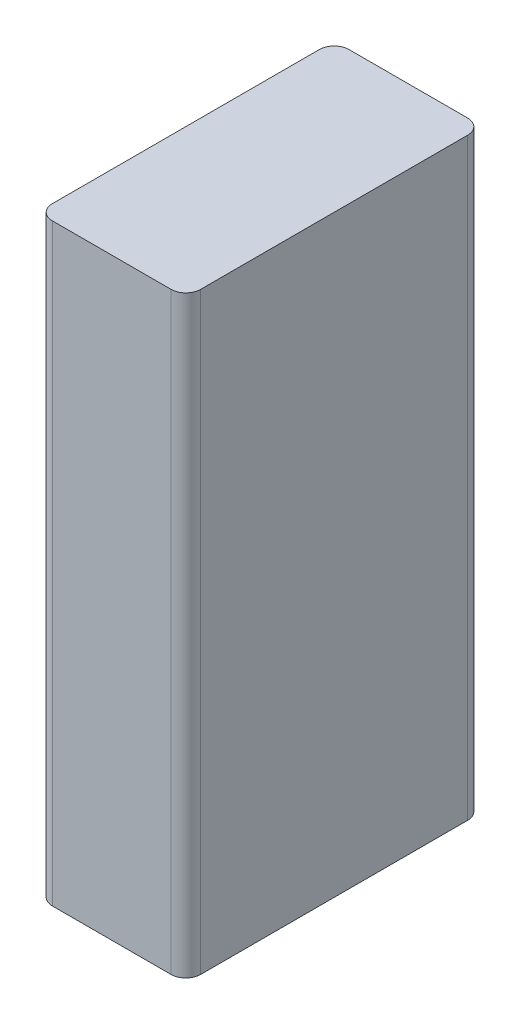
from build123d import *

# Parameters (mm, degrees)
SKETCH1_W           = 10
SKETCH1_H           = 20
BOSS_EXTRUDE1_DEPTH = 40
FILLET1_R           = 1


with BuildPart() as part:
    # Sketch1 → Boss-Extrude1 (new body)
    with BuildSketch(Plane(origin=(0, 0, 0), x_dir=(1, 0, 0), z_dir=(0, 1, 0))):
        Rectangle(SKETCH1_W, SKETCH1_H)
    extrude(amount=BOSS_EXTRUDE1_DEPTH)

    # Fillet1
    fillet1_edges = [part.edges().sort_by_distance(p)[0] for p in [
        (5, 20, 10),
        (-5, 20, 10),
        (-5, 20, -10),
        (5, 20, -10),
    ]]
    fillet(fillet1_edges, radius=FILLET1_R)


solid = part.part
